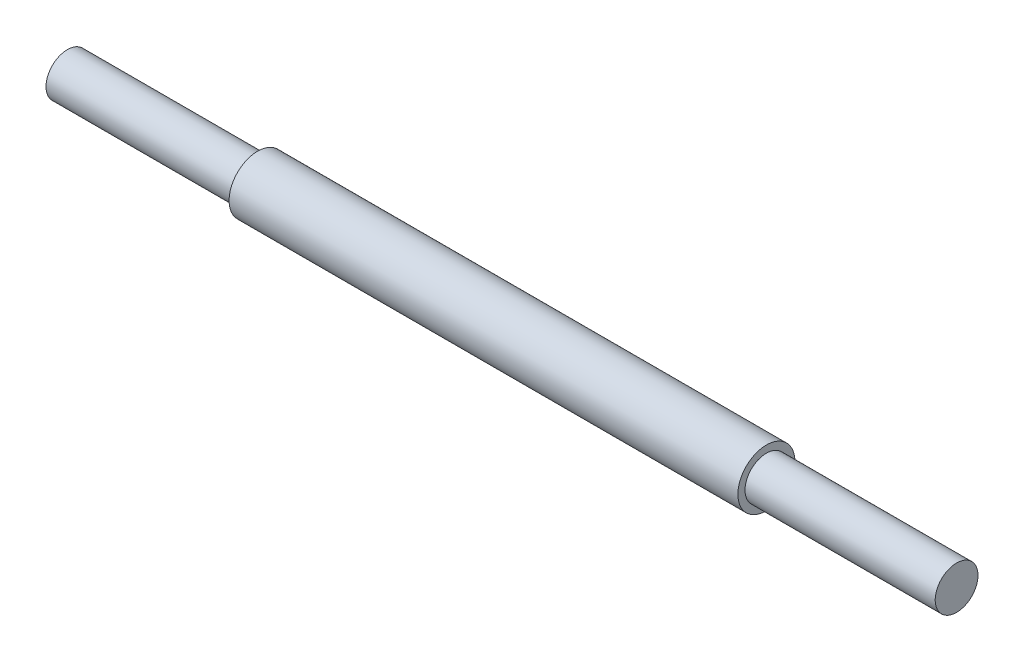
from build123d import *

# Parameters (mm, degrees)
ESQUISSE1_R        = 12
BOSS_EXTRU_1_DEPTH = 214
ESQUISSE2_R        = 9
BOSS_EXTRU_2_DEPTH = 80
BOSS_EXTRU_3_START = 80
ESQUISSE3_R        = 9
BOSS_EXTRU_3_DEPTH = 80


with BuildPart() as part:
    # Esquisse1 → Boss.-Extru.1 (new body)
    with BuildSketch(Plane(origin=(0, 0, 0), x_dir=(0, 0, -1), z_dir=(1, 0, 0))):
        with Locations((-11.866051887, 7.685965427)):
            Circle(ESQUISSE1_R)
    extrude(amount=BOSS_EXTRU_1_DEPTH)

    # Esquisse2 → Boss.-Extru.2 (add)
    with BuildSketch(Plane(origin=(214, 0, 0), x_dir=(0, 0, -1), z_dir=(1, 0, 0))):
        with Locations((-11.866051887, 7.685965427)):
            Circle(ESQUISSE2_R)
    extrude(amount=BOSS_EXTRU_2_DEPTH)

    # Esquisse3 → Boss.-Extru.3 (add)
    with BuildSketch(Plane.ZY.offset(BOSS_EXTRU_3_START)):
        with Locations(Location((11.866051887, 7.685965427, 0), (0, 0, 180))):
            Circle(ESQUISSE3_R)
    extrude(amount=-BOSS_EXTRU_3_DEPTH)


solid = part.part
